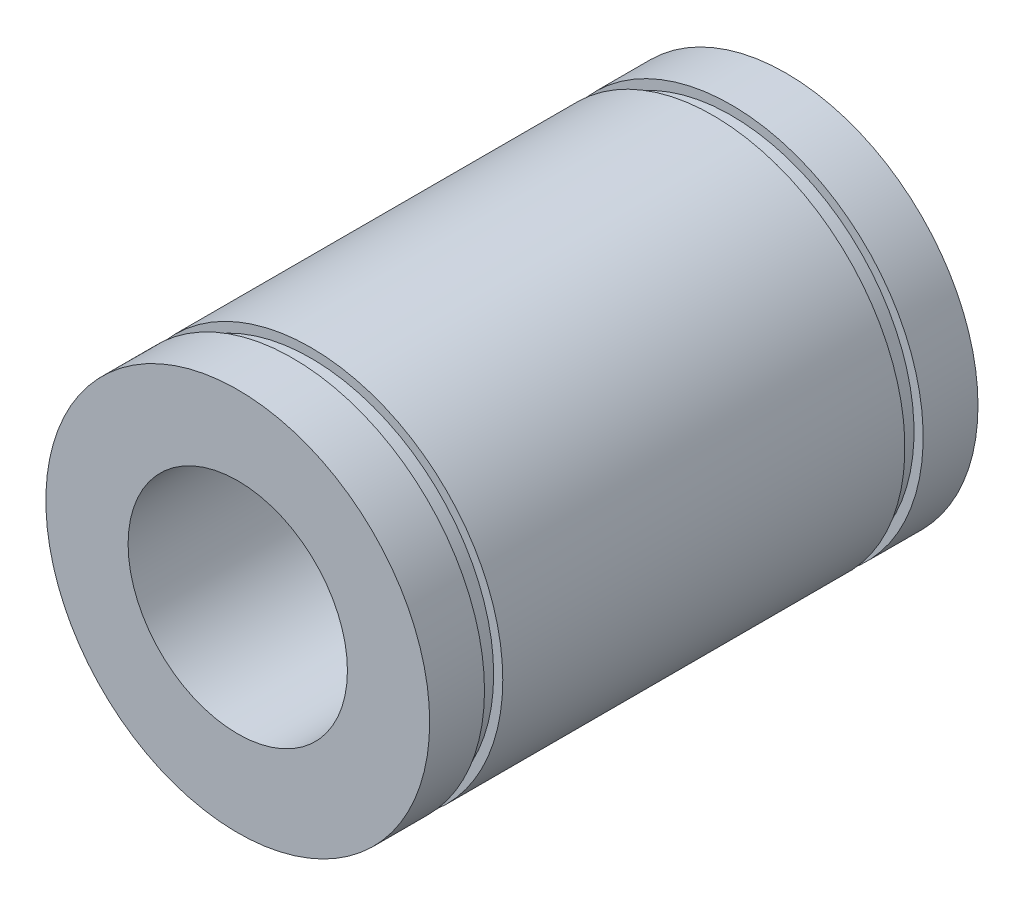
from build123d import *

# Parameters (mm, degrees)
SKETCH1_R           = 10.5
BOSS_EXTRUDE1_DEPTH = 30
SKETCH2_R           = 6
CUT_EXTRUDE1_DEPTH  = 30
CUT_EXTRUDE2_START  = -3
SKETCH3_R           = 10.5
SKETCH3_R_2         = 10
CUT_EXTRUDE2_DEPTH  = 1
CUT_EXTRUDE3_START  = -4
SKETCH4_R           = 10.5
SKETCH4_R_2         = 10
CUT_EXTRUDE3_DEPTH  = 1


with BuildPart() as part:
    # Sketch1 → Boss-Extrude1 (new body)
    with BuildSketch(Plane.XY):
        Circle(SKETCH1_R)
    extrude(amount=BOSS_EXTRUDE1_DEPTH)

    # Sketch2 → Cut-Extrude1 (cut)
    with BuildSketch(Plane(origin=(0, 0, 0), x_dir=(-1, 0, 0), z_dir=(0, 0, -1))):
        with Locations((0, 0.188162924)):
            Circle(SKETCH2_R)
    extrude(amount=-CUT_EXTRUDE1_DEPTH, mode=Mode.SUBTRACT)

    # Sketch3 → Cut-Extrude2 (cut)
    with BuildSketch(Plane(origin=(0, 0, 0), x_dir=(-1, 0, 0), z_dir=(0, 0, -1)).offset(CUT_EXTRUDE2_START)):
        Circle(SKETCH3_R)
        Circle(SKETCH3_R_2, mode=Mode.SUBTRACT)
    extrude(amount=-CUT_EXTRUDE2_DEPTH, mode=Mode.SUBTRACT)

    # Sketch4 → Cut-Extrude3 (cut)
    with BuildSketch(Plane.XY.offset(30).offset(CUT_EXTRUDE3_START)):
        with Locations(Location((0, 0, 0), (0, 0, 180))):
            Circle(SKETCH4_R)
        with Locations(Location((0, 0, 0), (0, 0, 180))):
            Circle(SKETCH4_R_2, mode=Mode.SUBTRACT)
    extrude(amount=CUT_EXTRUDE3_DEPTH, mode=Mode.SUBTRACT)


solid = part.part
